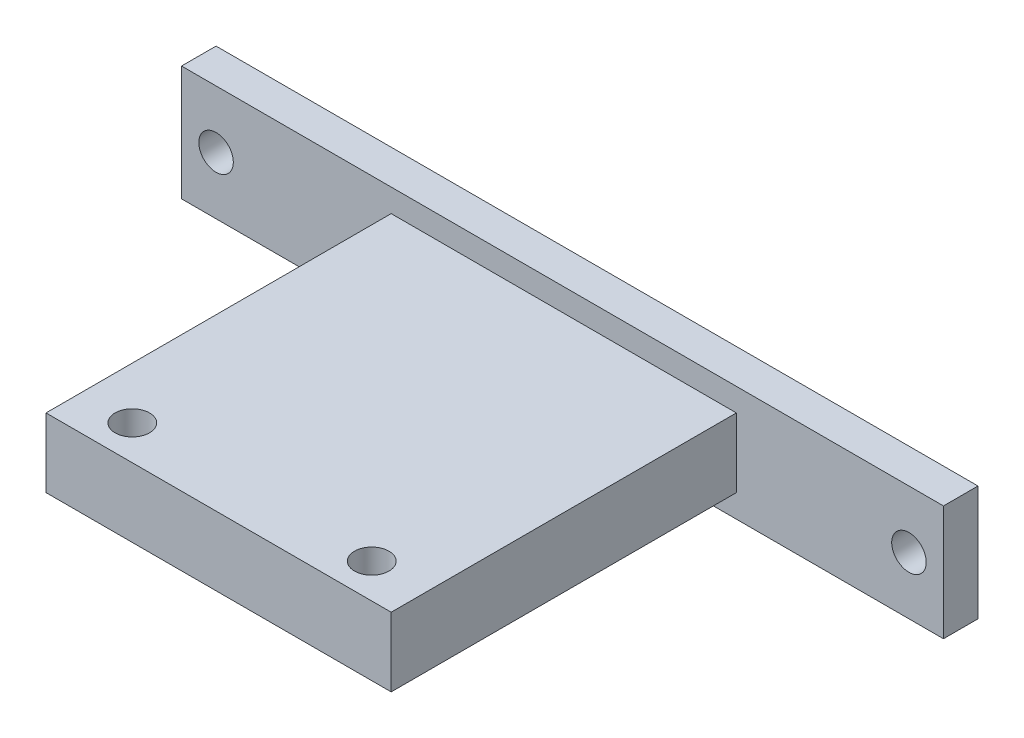
from build123d import *

# Parameters (mm, degrees)
SKETCH1_W                = 66.22
SKETCH1_H                = 10
SKETCH1_R                = 1.5
BOSS_EXTRUDE1_DEPTH      = 3
BOSS_EXTRUDE2_DEPTH      = 3
BOSS_EXTRUDE2_DEPTH_BACK = 3
SKETCH2_W                = 30
SKETCH2_H                = 30
SKETCH3_R                = 1.5
CUT_EXTRUDE1_DEPTH       = 72.76188682


with BuildPart() as part:
    # Sketch1 → Boss-Extrude1 (new body)
    with BuildSketch(Plane.XY):
        with Locations((30.11, 5)):
            Rectangle(SKETCH1_W, SKETCH1_H)
        with Locations((0, 5)):
            Circle(SKETCH1_R, mode=Mode.SUBTRACT)
        with Locations((60.22, 5)):
            Circle(SKETCH1_R, mode=Mode.SUBTRACT)
    extrude(amount=BOSS_EXTRUDE1_DEPTH)

    # Sketch2 → Boss-Extrude2 (add, two sides: drawn at the far end of the back side and taken through both)
    with BuildSketch(Plane(origin=(0, 5, 0), x_dir=(1, 0, 0), z_dir=(0, 1, 0)).offset(-BOSS_EXTRUDE2_DEPTH_BACK)):
        with Locations((30.22, -18)):
            Rectangle(SKETCH2_W, SKETCH2_H)
    extrude(amount=BOSS_EXTRUDE2_DEPTH + BOSS_EXTRUDE2_DEPTH_BACK)

    # Sketch3 → Cut-Extrude1 (cut, through all)
    with BuildSketch(Plane.XZ.offset(-2)):
        with Locations(Location((19.72, 30, 0), (0, 0, 270))):
            Circle(SKETCH3_R)
        with Locations(Location((40.53, 30, 0), (0, 0, 270))):
            Circle(SKETCH3_R)
    extrude(amount=-CUT_EXTRUDE1_DEPTH, mode=Mode.SUBTRACT)


solid = part.part
